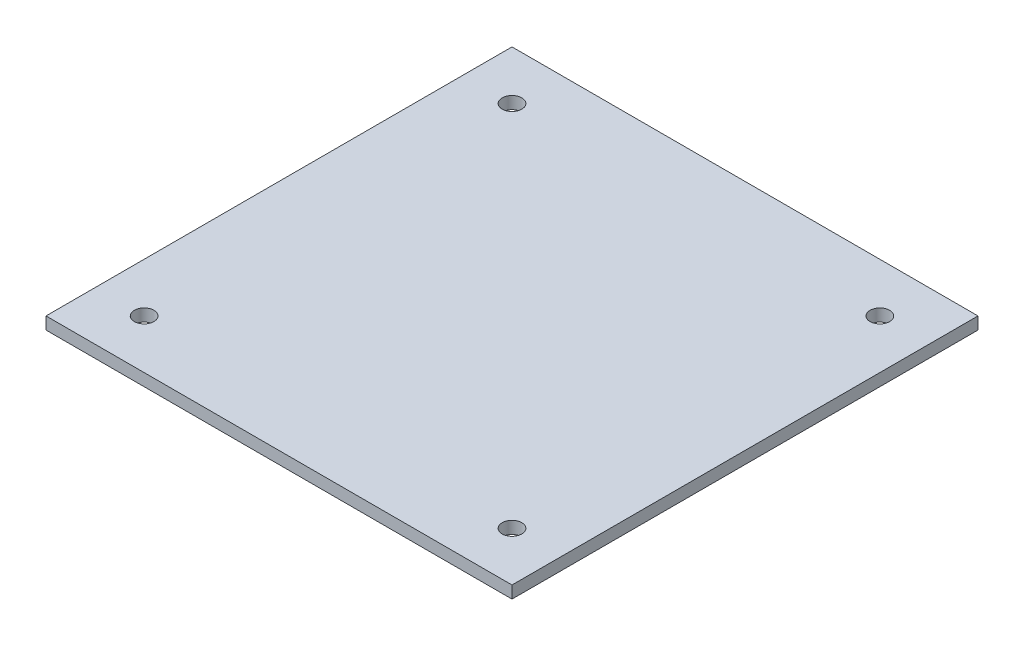
from build123d import *

# Parameters (mm, degrees)
SKETCH_1_W                  = 76
SKETCH_1_H                  = 76
EXTRUDE_1_DEPTH             = 2
SKETCH_2_R                  = 1.6
CUT_EXTRUDE_1_DEPTH         = 2
PATTERN_LINEAR_1_COUNT      = 2
PATTERN_LINEAR_1_PITCH      = 60
PATTERN_LINEAR_1_COUNT_DIR2 = 2
PATTERN_LINEAR_1_PITCH_DIR2 = 60


with BuildPart() as part:
    # 草图1 → 凸台-拉伸1 (new body)
    with BuildSketch(Plane(origin=(0, 0, 0), x_dir=(1, 0, 0), z_dir=(0, 1, 0))):
        Rectangle(SKETCH_1_W, SKETCH_1_H)
    extrude(amount=EXTRUDE_1_DEPTH)

    # 草图2 → 切除-拉伸1 (cut)
    with BuildSketch(Plane(origin=(0, 2, 0), x_dir=(1, 0, 0), z_dir=(0, 1, 0))):
        with Locations(Location((-30, 30, 0), (0, 0, 270))):
            Circle(SKETCH_2_R)
    cut_extrude_1 = extrude(amount=-CUT_EXTRUDE_1_DEPTH, mode=Mode.SUBTRACT)

    # 阵列(线性)1: Cut-Extrude 1 2 × 2
    with Locations(*[(i * PATTERN_LINEAR_1_PITCH, 0, j * PATTERN_LINEAR_1_PITCH_DIR2) for i in range(PATTERN_LINEAR_1_COUNT) for j in range(PATTERN_LINEAR_1_COUNT_DIR2) if (i, j) != (0, 0)]):
        add(cut_extrude_1, mode=Mode.SUBTRACT)


solid = part.part
